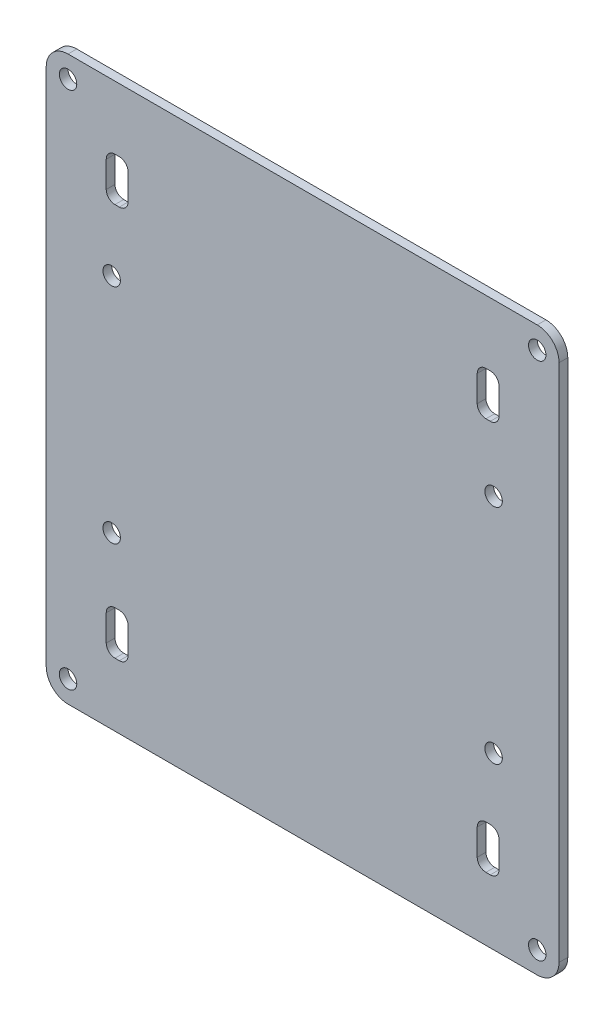
from build123d import *

# Parameters (mm, degrees)
SKETCH1_R           = 2
BOSS_EXTRUDE1_DEPTH = 2
CUT_EXTRUDE1_DEPTH  = 3


with BuildPart() as part:
    # Sketch1 → Boss-Extrude1 (new body)
    with BuildSketch(Plane.XY):
        with BuildLine():
            Line((69, -42.5), (176.5, -42.5))
            ThreePointArc((176.5, -42.5), (180.035533906, -43.964466094), (181.5, -47.5))
            Line((181.5, -47.5), (181.5, -166.5))
            ThreePointArc((181.5, -166.5), (180.035533906, -170.035533906), (176.5, -171.5))
            Line((176.5, -171.5), (69, -171.5))
            ThreePointArc((69, -171.5), (65.464466094, -170.035533906), (64, -166.5))
            Line((64, -166.5), (64, -47.5))
            ThreePointArc((64, -47.5), (65.464466094, -43.964466094), (69, -42.5))
        make_face()
        with Locations((166.5, -81.5)):
            Circle(SKETCH1_R, mode=Mode.SUBTRACT)
        with Locations((166.5, -132.5)):
            Circle(SKETCH1_R, mode=Mode.SUBTRACT)
        with Locations((79, -132.5)):
            Circle(SKETCH1_R, mode=Mode.SUBTRACT)
        with Locations((79, -81.5)):
            Circle(SKETCH1_R, mode=Mode.SUBTRACT)
        with Locations((69, -166.5)):
            Circle(SKETCH1_R, mode=Mode.SUBTRACT)
        with Locations((176.5, -166.5)):
            Circle(SKETCH1_R, mode=Mode.SUBTRACT)
        with Locations((176.5, -47.5)):
            Circle(SKETCH1_R, mode=Mode.SUBTRACT)
        with Locations((69, -47.5)):
            Circle(SKETCH1_R, mode=Mode.SUBTRACT)
    extrude(amount=BOSS_EXTRUDE1_DEPTH)

    # Sketch2 → Cut-Extrude1 (cut)
    with BuildSketch(Plane.XY.offset(2)):
        with BuildLine():
            Line((79.75, -57), (80.75, -57))
            ThreePointArc((80.75, -57), (82.164213562, -57.585786438), (82.75, -59))
            Line((82.75, -59), (82.75, -65))
            ThreePointArc((82.75, -65), (82.164213562, -66.414213562), (80.75, -67))
            Line((80.75, -67), (79.75, -67))
            ThreePointArc((79.75, -67), (78.335786438, -66.414213562), (77.75, -65))
            Line((77.75, -65), (77.75, -59))
            ThreePointArc((77.75, -59), (78.335786438, -57.585786438), (79.75, -57))
        make_face()
        with BuildLine():
            Line((162.75, -59), (162.75, -65))
            ThreePointArc((162.75, -65), (163.335786438, -66.414213562), (164.75, -67))
            Line((164.75, -67), (165.75, -67))
            ThreePointArc((165.75, -67), (167.164213562, -66.414213562), (167.75, -65))
            Line((167.75, -65), (167.75, -59))
            ThreePointArc((167.75, -59), (167.164213562, -57.585786438), (165.75, -57))
            Line((165.75, -57), (164.75, -57))
            ThreePointArc((164.75, -57), (163.335786438, -57.585786438), (162.75, -59))
        make_face()
        with BuildLine():
            Line((165.75, -157), (164.75, -157))
            ThreePointArc((164.75, -157), (163.335786438, -156.414213562), (162.75, -155))
            Line((162.75, -155), (162.75, -149))
            ThreePointArc((162.75, -149), (163.335786438, -147.585786438), (164.75, -147))
            Line((164.75, -147), (165.75, -147))
            ThreePointArc((165.75, -147), (167.164213562, -147.585786438), (167.75, -149))
            Line((167.75, -149), (167.75, -155))
            ThreePointArc((167.75, -155), (167.164213562, -156.414213562), (165.75, -157))
        make_face()
        with BuildLine():
            Line((82.75, -155), (82.75, -149))
            ThreePointArc((82.75, -149), (82.164213562, -147.585786438), (80.75, -147))
            Line((80.75, -147), (79.75, -147))
            ThreePointArc((79.75, -147), (78.335786438, -147.585786438), (77.75, -149))
            Line((77.75, -149), (77.75, -155))
            ThreePointArc((77.75, -155), (78.335786438, -156.414213562), (79.75, -157))
            Line((79.75, -157), (80.75, -157))
            ThreePointArc((80.75, -157), (82.164213562, -156.414213562), (82.75, -155))
        make_face()
    extrude(amount=-CUT_EXTRUDE1_DEPTH, mode=Mode.SUBTRACT)


solid = part.part
